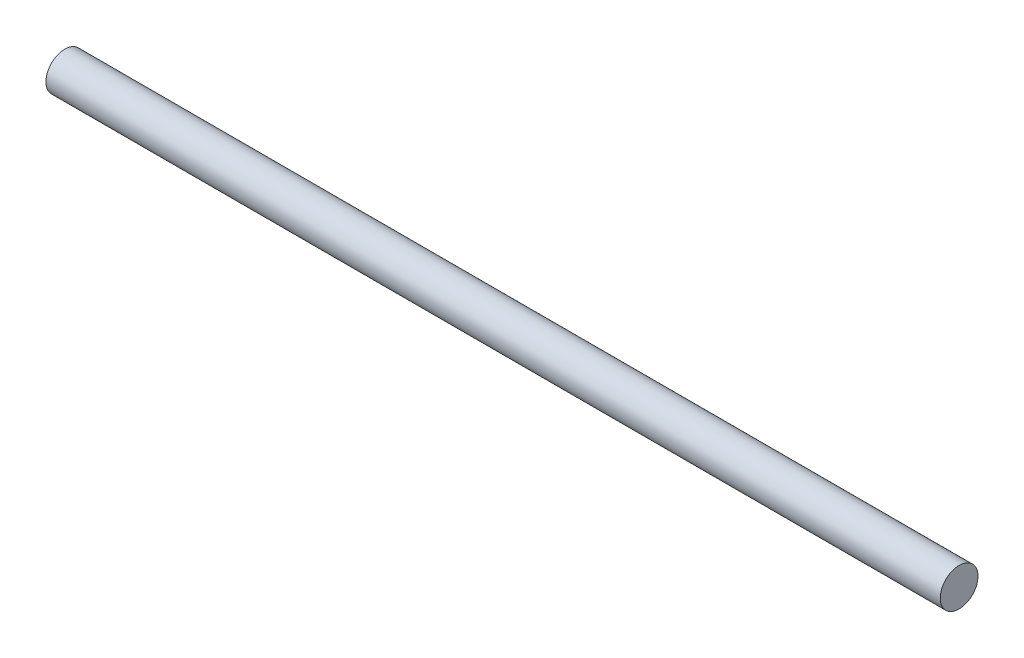
from build123d import *

# Parameters (mm, degrees)
ESBO_O1_R                = 1.5
RESSALTO_EXTRUS_O1_DEPTH = 71


with BuildPart() as part:
    # Esboço1 → Ressalto-extrusão1 (new body)
    with BuildSketch(Plane(origin=(0, 0, 0), x_dir=(0, 0, -1), z_dir=(1, 0, 0))):
        Circle(ESBO_O1_R)
    extrude(amount=RESSALTO_EXTRUS_O1_DEPTH)


solid = part.part
